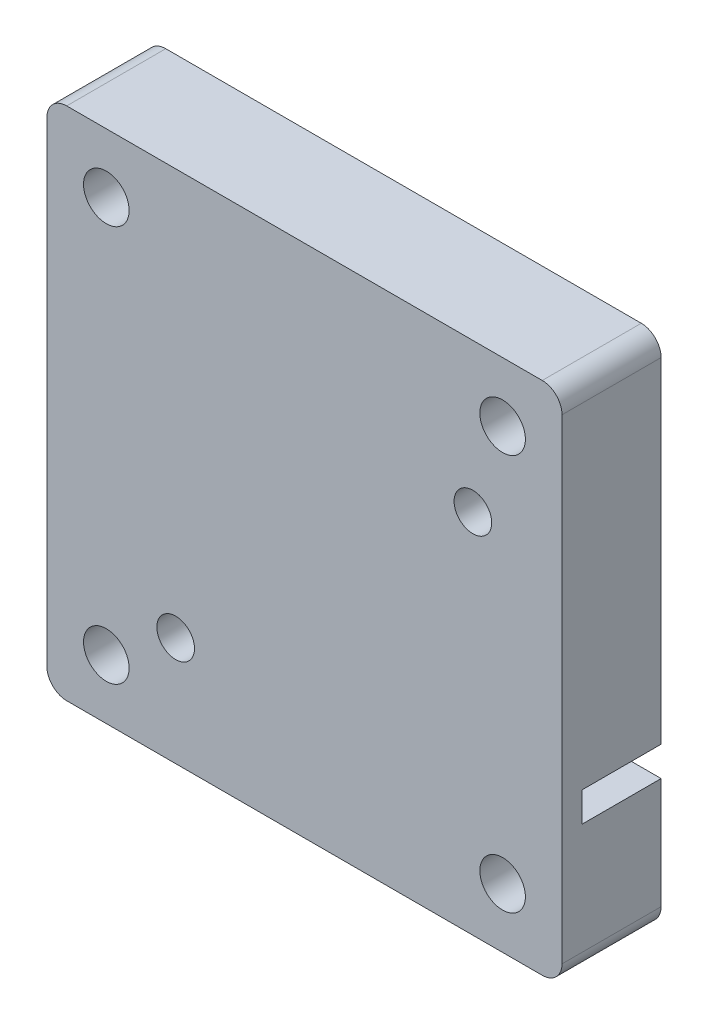
from build123d import *

# Parameters (mm, degrees)
SKETCH1_W           = 26
SKETCH1_H           = 26
SKETCH1_R           = 1.15
SKETCH1_R_2         = 0.95
SKETCH1_W_2         = 12.1
SKETCH1_H_2         = 6.1
BOSS_EXTRUDE1_DEPTH = 4
SKETCH7_W           = 26
SKETCH7_H           = 26
SKETCH7_R           = 0.95
SKETCH7_R_2         = 1.15
BOSS_EXTRUDE4_DEPTH = 1
SKETCH8_R           = 2.1
CUT_EXTRUDE5_DEPTH  = 2.2
SKETCH3_W           = 5.4
SKETCH3_H           = 1.5
CUT_EXTRUDE6_DEPTH  = 4
CHAMFER2_SIZE       = 1.5
FILLET1_R           = 1


with BuildPart() as part:
    # Sketch1 → Boss-Extrude1 (new body)
    with BuildSketch(Plane.XY):
        with Locations((-1, 1)):
            Rectangle(SKETCH1_W, SKETCH1_H)
        with Locations((-11, 11)):
            Circle(SKETCH1_R, mode=Mode.SUBTRACT)
        with Locations((9, 11)):
            Circle(SKETCH1_R, mode=Mode.SUBTRACT)
        with Locations((9, -9)):
            Circle(SKETCH1_R, mode=Mode.SUBTRACT)
        with Locations((-11, -9)):
            Circle(SKETCH1_R, mode=Mode.SUBTRACT)
        with Locations((7.5, 6.5)):
            Circle(SKETCH1_R_2, mode=Mode.SUBTRACT)
        with Locations((-7.5, -6.5)):
            Circle(SKETCH1_R_2, mode=Mode.SUBTRACT)
        with Locations((0.55, -4.65)):
            Rectangle(SKETCH1_W_2, SKETCH1_H_2, mode=Mode.SUBTRACT)
    extrude(amount=BOSS_EXTRUDE1_DEPTH)

    # Sketch7 → Boss-Extrude4 (add)
    with BuildSketch(Plane.XY.offset(4)):
        with Locations((-1, 1)):
            Rectangle(SKETCH7_W, SKETCH7_H)
        with Locations((7.5, 6.5)):
            Circle(SKETCH7_R, mode=Mode.SUBTRACT)
        with Locations((-7.5, -6.5)):
            Circle(SKETCH7_R, mode=Mode.SUBTRACT)
        with Locations((-11, -9)):
            Circle(SKETCH7_R_2, mode=Mode.SUBTRACT)
        with Locations((9, -9)):
            Circle(SKETCH7_R_2, mode=Mode.SUBTRACT)
        with Locations((9, 11)):
            Circle(SKETCH7_R_2, mode=Mode.SUBTRACT)
        with Locations((-11, 11)):
            Circle(SKETCH7_R_2, mode=Mode.SUBTRACT)
    extrude(amount=BOSS_EXTRUDE4_DEPTH)

    # Sketch8 → Cut-Extrude5 (cut)
    with BuildSketch(Plane(origin=(0, 0, 0), x_dir=(-1, 0, 0), z_dir=(0, 0, -1))):
        with Locations((-9, 11)):
            Circle(SKETCH8_R)
        with Locations((11, 11)):
            Circle(SKETCH8_R)
        with Locations((11, -9)):
            Circle(SKETCH8_R)
        with Locations((-9, -9)):
            Circle(SKETCH8_R)
    extrude(amount=-CUT_EXTRUDE5_DEPTH, mode=Mode.SUBTRACT)

    # Sketch3 → Cut-Extrude6 (cut)
    with BuildSketch(Plane(origin=(0, 0, 0), x_dir=(-1, 0, 0), z_dir=(0, 0, -1))):
        with Locations((-9.3, -4.65)):
            Rectangle(SKETCH3_W, SKETCH3_H)
    extrude(amount=-CUT_EXTRUDE6_DEPTH, mode=Mode.SUBTRACT)

    # Chamfer2
    chamfer2_edges = [part.edges().sort_by_distance(p)[0] for p in [
        (6.6, -5.4, 2),
        (6.6, -3.9, 2),
    ]]
    chamfer(chamfer2_edges, length=CHAMFER2_SIZE)

    # Fillet1
    fillet1_edges = [part.edges().sort_by_distance(p)[0] for p in [
        (12, -12, 2.5),
        (-14, -12, 2.5),
        (-14, 14, 2.5),
        (12, 14, 2.5),
    ]]
    fillet(fillet1_edges, radius=FILLET1_R)


solid = part.part
